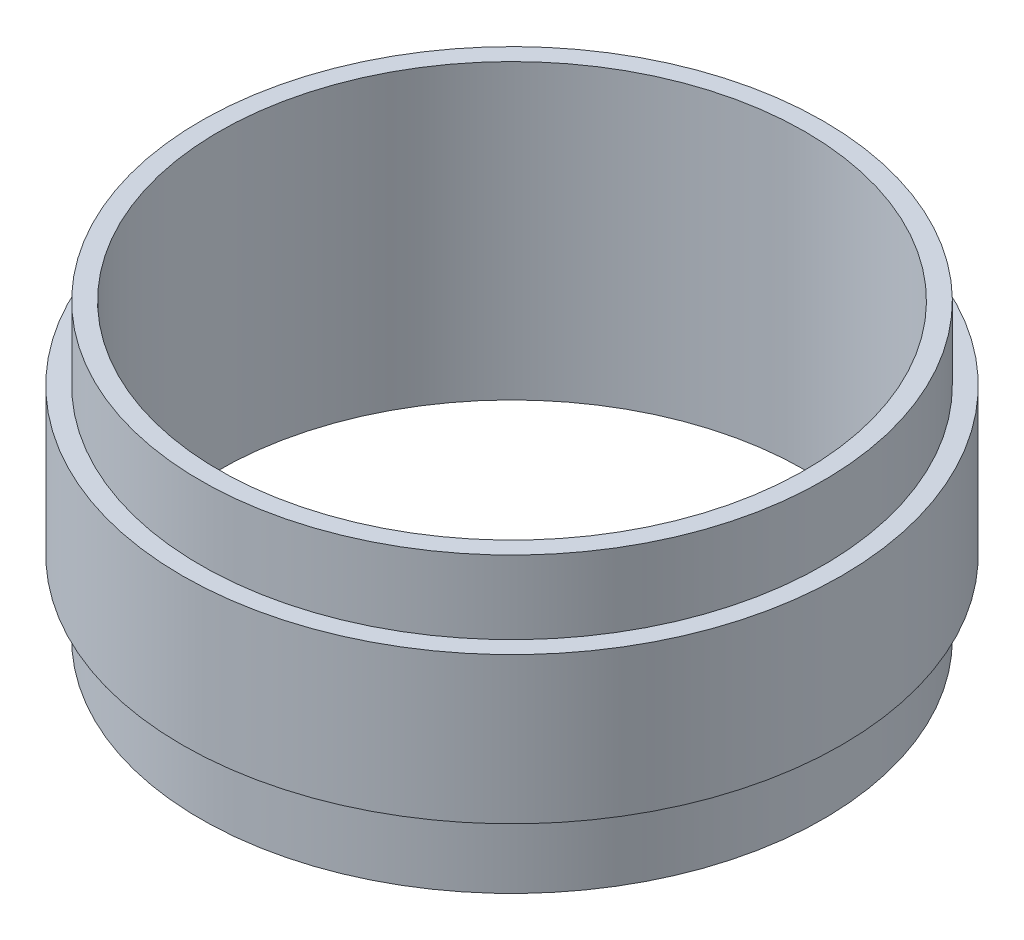
from build123d import *


with BuildPart() as part:
    # Reconstructed nominal axial profile → Native revolved geometry (revolve)
    with BuildSketch(Plane.XY, mode=Mode.PRIVATE) as native_revolved_geometry_sk:
        Polygon((8, -80), (8, -72), (8.5, -72), (8.5, -74), (9, -74), (9, -78), (8.5, -78), (8.5, -80), align=None)
    revolve(native_revolved_geometry_sk.sketch.rotate(Axis((0, -500, 0), (0, 1, 0)), 90), axis=Axis((0, -500, 0), (0, 1, 0)))


solid = part.part
